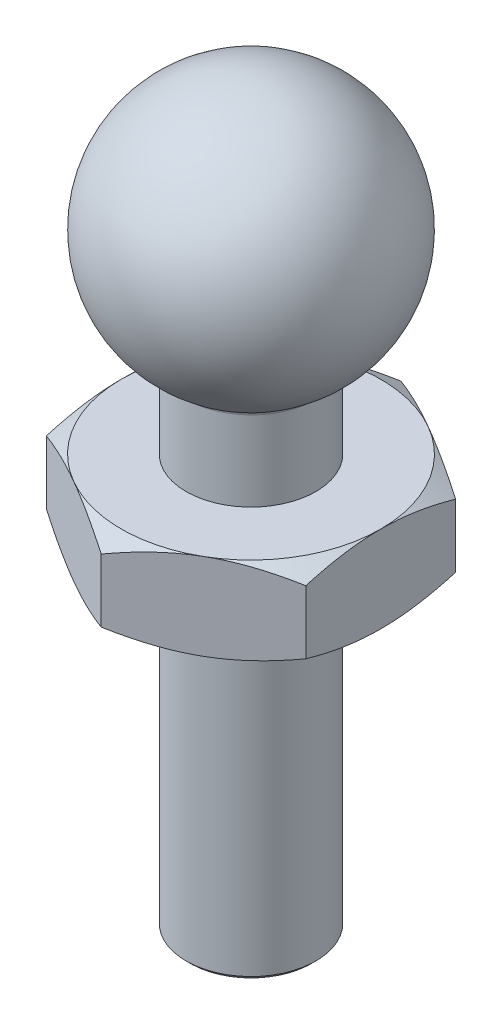
from build123d import *

# Parameters (mm, degrees)
CHAMFER1_SIZE       = 0.1
SKETCH4_R           = 1.5
BOSS_EXTRUDE1_DEPTH = 2
SKETCH5_OUTSIDE_W   = 18.79
SKETCH5_OUTSIDE_H   = 19.718
SKETCH5_OUTSIDE_R   = 3
CUT_EXTRUDE7_DEPTH  = 2
CUT_EXTRUDE7_DRAFT  = -60
SKETCH6_OUTSIDE_W   = 18.79
SKETCH6_OUTSIDE_H   = 19.718
SKETCH6_OUTSIDE_R   = 3
CUT_EXTRUDE8_DEPTH  = 2
CUT_EXTRUDE8_DRAFT  = -60
FILLET1_R           = 0.1


with BuildPart() as part:
    # Sketch1 → Revolve1 (revolve)
    with BuildSketch(Plane.XY, mode=Mode.PRIVATE) as revolve1_sk:
        with BuildLine():
            ThreePointArc((1.5, 11.401923789), (0.776457135, 11.102222521), (0, 11))
            Line((0, 11), (0, 0))
            Line((0, 0), (1.5, 0))
            Line((1.5, 0), (1.5, 11.401923789))
        make_face()
        with BuildLine():
            ThreePointArc((0, 17), (3, 14), (0, 11))
            Line((0, 11), (0, 17))
        make_face()
    revolve(revolve1_sk.sketch.rotate(Axis((0, 11, 0), (0, -1, 0)), 180), axis=Axis((0, 11, 0), (0, -1, 0)))

    # Chamfer1
    chamfer1_edges = [part.edges().sort_by_distance(p)[0] for p in [
        (1.5, 0, 0),
    ]]
    chamfer(chamfer1_edges, length=CHAMFER1_SIZE)

    # Fillet1
    fillet1_edges = [part.edges().sort_by_distance(p)[0] for p in [
        (1.5, 11.401923789, 0),
    ]]
    fillet(fillet1_edges, radius=FILLET1_R)


with BuildPart() as body_2:
    # Sketch4 → Boss-Extrude1 (new body)
    with BuildSketch(Plane(origin=(0, 7.5, 0), x_dir=(1, 0, 0), z_dir=(0, 1, 0))):
        Polygon((0, 3.464101615), (-3, 1.732050808), (-3, -1.732050808), (0, -3.464101615), (3, -1.732050808), (3, 1.732050808), align=None)
        with Locations(Location((0, 0, 0), (0, 0, 270))):
            Circle(SKETCH4_R, mode=Mode.SUBTRACT)
    extrude(amount=BOSS_EXTRUDE1_DEPTH)


with BuildPart() as cut_extrude7_tool:
    # Sketch5 outside → Cut-Extrude7 (with draft: the straight prism first)
    with BuildSketch(Plane.XZ.offset(-7.5)):
        Rectangle(SKETCH5_OUTSIDE_W, SKETCH5_OUTSIDE_H)
        Circle(SKETCH5_OUTSIDE_R, mode=Mode.SUBTRACT)
    extrude(amount=-CUT_EXTRUDE7_DEPTH)
    # Cut-Extrude7: the draft: its side faces are tilted about the plane it starts from
    cut_extrude7_sides = [cut_extrude7_tool.faces().sort_by_distance(p)[0] for p in [
        (0, 8.5, -9.859),
        (9.395, 8.5, 0),
        (0, 8.5, 9.859),
        (-9.395, 8.5, 0),
        (-3, 8.5, 0),
    ]]
    draft(cut_extrude7_sides, Plane.XZ.offset(-7.5), CUT_EXTRUDE7_DRAFT)


with BuildPart() as body_2_1:
    add(body_2.part)

    # Cut-Extrude7: cut by cut_extrude7_tool
    add(cut_extrude7_tool.part, mode=Mode.SUBTRACT)


with BuildPart() as cut_extrude8_tool:
    # Sketch6 outside → Cut-Extrude8 (with draft: the straight prism first)
    with BuildSketch(Plane(origin=(0, 9.5, 0), x_dir=(1, 0, 0), z_dir=(0, 1, 0))):
        Rectangle(SKETCH6_OUTSIDE_W, SKETCH6_OUTSIDE_H)
        Circle(SKETCH6_OUTSIDE_R, mode=Mode.SUBTRACT)
    extrude(amount=-CUT_EXTRUDE8_DEPTH)
    # Cut-Extrude8: the draft: its side faces are tilted about the plane it starts from
    cut_extrude8_sides = [cut_extrude8_tool.faces().sort_by_distance(p)[0] for p in [
        (0, 8.5, 9.859),
        (9.395, 8.5, 0),
        (0, 8.5, -9.859),
        (-9.395, 8.5, 0),
        (-3, 8.5, 0),
    ]]
    draft(cut_extrude8_sides, Plane(origin=(0, 9.5, 0), x_dir=(1, 0, 0), z_dir=(0, 1, 0)), CUT_EXTRUDE8_DRAFT)


with BuildPart() as body_2_2:
    add(body_2_1.part)

    # Cut-Extrude8: cut by cut_extrude8_tool
    add(cut_extrude8_tool.part, mode=Mode.SUBTRACT)


solid = Compound([part.part, body_2_2.part])
